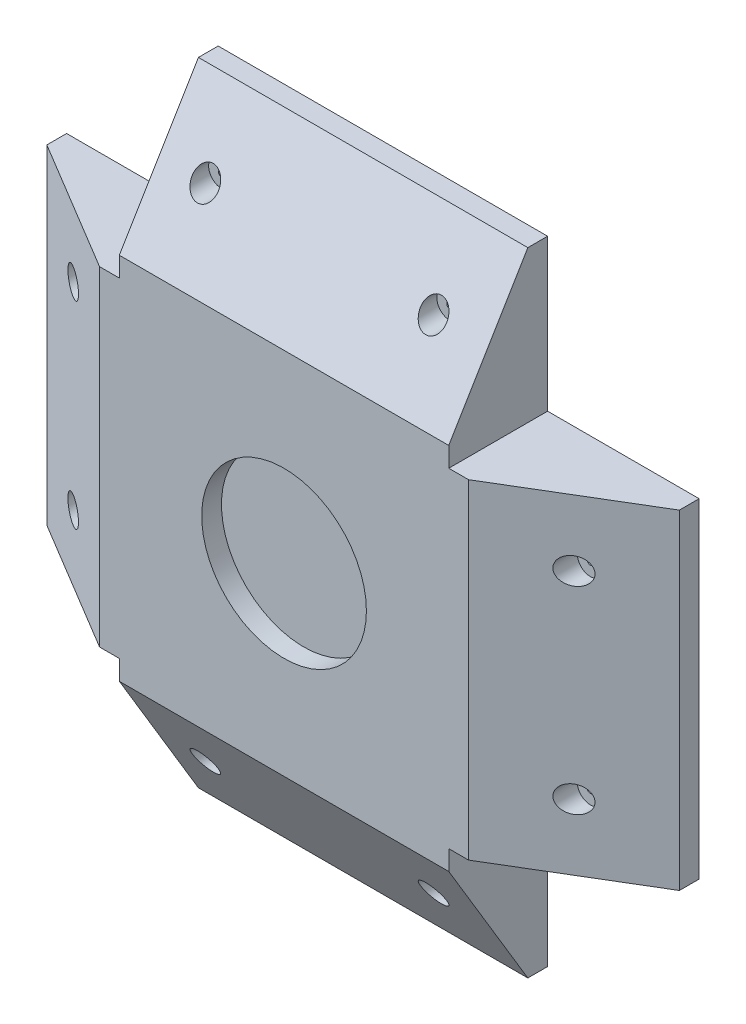
from build123d import *

# Parameters (mm, degrees)
ESQUISSE1_W              = 100
ESQUISSE1_H              = 100
BOSS_EXTRU_1_DEPTH       = 6
ESQUISSE2_W              = 30
ESQUISSE2_H              = 100
BOSS_EXTRU_2_DEPTH       = 6
ESQUISSE3_W              = 30
ESQUISSE3_H              = 100
BOSS_EXTRU_3_DEPTH       = 6
ESQUISSE4_W              = 6
ESQUISSE4_H              = 100
BOSS_EXTRU_4_DEPTH       = 40
ESQUISSE5_W              = 6
ESQUISSE5_H              = 100
BOSS_EXTRU_5_DEPTH       = 40
BOSS_EXTRU_7_DEPTH       = 100
BOSS_EXTRU_8_DEPTH       = 100
ESQUISSE9_R              = 1
ENL_V_MAT_EXTRU_1_DEPTH  = 60
ESQUISSE10_R             = 4
ENL_V_MAT_EXTRU_2_DEPTH  = 17
BOSS_EXTRU_27_DEPTH      = 6
BOSS_EXTRU_27_DEPTH_BACK = 3
ESQUISSE28_W             = 100
ESQUISSE28_H             = 30
ESQUISSE29_W             = 100
ESQUISSE29_H             = 6
BOSS_EXTRU_28_DEPTH      = 40
BOSS_EXTRU_30_DEPTH      = 6
BOSS_EXTRU_30_DEPTH_BACK = 3
ESQUISSE30_W             = 100
ESQUISSE30_H             = 30
ESQUISSE31_W             = 100
ESQUISSE31_H             = 6
BOSS_EXTRU_31_DEPTH      = 40
BOSS_EXTRU_32_DEPTH      = 100
BOSS_EXTRU_33_DEPTH      = 100
ESQUISSE34_R             = 1
ENL_V_MAT_EXTRU_7_DEPTH  = 100
ESQUISSE35_R             = 4
ENL_V_MAT_EXTRU_8_DEPTH  = 17
ESQUISSE36_R             = 25
ENL_V_MAT_EXTRU_9_DEPTH  = 6
ESQUISSE37_W             = 100
ESQUISSE37_H             = 94.110781927
BOSS_EXTRU_34_DEPTH      = 24


with BuildPart() as part:
    # Esquisse1 → Boss.-Extru.1 (new body)
    with BuildSketch(Plane.XY):
        Rectangle(ESQUISSE1_W, ESQUISSE1_H)
    extrude(amount=BOSS_EXTRU_1_DEPTH)

    # Esquisse2 → Boss.-Extru.2 (add)
    with BuildSketch(Plane.ZY.offset(50)):
        with Locations((-9, 0)):
            Rectangle(ESQUISSE2_W, ESQUISSE2_H)
    extrude(amount=BOSS_EXTRU_2_DEPTH)

    # Esquisse3 → Boss.-Extru.3 (add)
    with BuildSketch(Plane(origin=(50, 0, 0), x_dir=(0, 0, -1), z_dir=(1, 0, 0))):
        with Locations((9, 0)):
            Rectangle(ESQUISSE3_W, ESQUISSE3_H)
    extrude(amount=BOSS_EXTRU_3_DEPTH)

    # Esquisse4 → Boss.-Extru.4 (add)
    with BuildSketch(Plane(origin=(56, 0, 0), x_dir=(0, 0, -1), z_dir=(1, 0, 0))):
        with Locations((21, 0)):
            Rectangle(ESQUISSE4_W, ESQUISSE4_H)
    extrude(amount=BOSS_EXTRU_4_DEPTH)

    # Esquisse5 → Boss.-Extru.5 (add)
    with BuildSketch(Plane.ZY.offset(56)):
        with Locations((-21, 0)):
            Rectangle(ESQUISSE5_W, ESQUISSE5_H)
    extrude(amount=BOSS_EXTRU_5_DEPTH)

    # Esquisse6 → Boss.-Extru.7 (add)
    with BuildSketch(Plane(origin=(0, 50, 0), x_dir=(1, 0, 0), z_dir=(0, 1, 0))):
        Polygon((-56, -6), (-56, 18), (-96, 18), align=None)
    extrude(amount=-BOSS_EXTRU_7_DEPTH)

    # Esquisse8 → Boss.-Extru.8 (add)
    with BuildSketch(Plane(origin=(0, -50, 0), x_dir=(-1, 0, 0), z_dir=(0, -1, 0))):
        Polygon((-56, -6), (-96, 18), (-56, 18), align=None)
    extrude(amount=-BOSS_EXTRU_8_DEPTH)

    # Esquisse9 → Enlèv. mat.-Extru.1 (cut)
    with BuildSketch(Plane(origin=(0, 0, -24), x_dir=(-1, 0, 0), z_dir=(0, 0, -1))):
        with Locations((-76, 30)):
            Circle(ESQUISSE9_R)
        with Locations((-76, -30)):
            Circle(ESQUISSE9_R)
        with Locations((76, -30)):
            Circle(ESQUISSE9_R)
        with Locations((76, 30)):
            Circle(ESQUISSE9_R)
    extrude(amount=-ENL_V_MAT_EXTRU_1_DEPTH, mode=Mode.SUBTRACT)

    # Esquisse10 → Enlèv. mat.-Extru.2 (cut)
    with BuildSketch(Plane.XY.offset(6)):
        with Locations((76, 30)):
            Circle(ESQUISSE10_R)
        with Locations((76, -30)):
            Circle(ESQUISSE10_R)
        with Locations((-76, -30)):
            Circle(ESQUISSE10_R)
        with Locations((-76, 30)):
            Circle(ESQUISSE10_R)
    extrude(amount=-ENL_V_MAT_EXTRU_2_DEPTH, mode=Mode.SUBTRACT)

    # Esquisse28 → Boss.-Extru.27 (add, two sides: drawn at the far end of the back side and taken through both)
    with BuildSketch(Plane(origin=(0, -50, 0), x_dir=(-1, 0, 0), z_dir=(0, -1, 0)).offset(-BOSS_EXTRU_27_DEPTH_BACK)):
        with Locations((0, 9)):
            Rectangle(ESQUISSE28_W, ESQUISSE28_H)
    extrude(amount=BOSS_EXTRU_27_DEPTH + BOSS_EXTRU_27_DEPTH_BACK)

    # Esquisse29 → Boss.-Extru.28 (add)
    with BuildSketch(Plane(origin=(0, -56, 0), x_dir=(-1, 0, 0), z_dir=(0, -1, 0))):
        with Locations((0, 21)):
            Rectangle(ESQUISSE29_W, ESQUISSE29_H)
    extrude(amount=BOSS_EXTRU_28_DEPTH)

    # Esquisse30 → Boss.-Extru.30 (add, two sides: drawn at the far end of the back side and taken through both)
    with BuildSketch(Plane(origin=(0, 50, 0), x_dir=(1, 0, 0), z_dir=(0, 1, 0)).offset(-BOSS_EXTRU_30_DEPTH_BACK)):
        with Locations((0, 9)):
            Rectangle(ESQUISSE30_W, ESQUISSE30_H)
    extrude(amount=BOSS_EXTRU_30_DEPTH + BOSS_EXTRU_30_DEPTH_BACK)

    # Esquisse31 → Boss.-Extru.31 (add)
    with BuildSketch(Plane(origin=(0, 56, 0), x_dir=(1, 0, 0), z_dir=(0, 1, 0))):
        with Locations((0, 21)):
            Rectangle(ESQUISSE31_W, ESQUISSE31_H)
    extrude(amount=BOSS_EXTRU_31_DEPTH)

    # Esquisse32 → Boss.-Extru.32 (add)
    with BuildSketch(Plane.ZY.offset(50)):
        Polygon((-18, -56), (6, -56), (-18, -96), align=None)
    extrude(amount=-BOSS_EXTRU_32_DEPTH)

    # Esquisse33 → Boss.-Extru.33 (add)
    with BuildSketch(Plane.ZY.offset(50)):
        Polygon((-18, 56), (6, 56), (-18, 96), align=None)
    extrude(amount=-BOSS_EXTRU_33_DEPTH)

    # Esquisse34 → Enlèv. mat.-Extru.7 (cut)
    with BuildSketch(Plane.XY.offset(6)):
        with Locations(Location((-35.892206296, -76, 0), (0, 0, 90))):
            Circle(ESQUISSE34_R)
        with Locations(Location((33.387808828, -76, 0), (0, 0, 90))):
            Circle(ESQUISSE34_R)
        with Locations(Location((33.387808828, 76, 0), (0, 0, 270))):
            Circle(ESQUISSE34_R)
        with Locations(Location((-35.892206296, 76, 0), (0, 0, 270))):
            Circle(ESQUISSE34_R)
    extrude(amount=-ENL_V_MAT_EXTRU_7_DEPTH, mode=Mode.SUBTRACT)

    # Esquisse35 → Enlèv. mat.-Extru.8 (cut)
    with BuildSketch(Plane.XY.offset(6)):
        with Locations((33.387808828, -76)):
            Circle(ESQUISSE35_R)
        with Locations((-35.892206296, -76)):
            Circle(ESQUISSE35_R)
        with Locations(Location((-35.892206296, 76, 0), (0, 0, 270))):
            Circle(ESQUISSE35_R)
        with Locations(Location((33.387808828, 76, 0), (0, 0, 270))):
            Circle(ESQUISSE35_R)
    extrude(amount=-ENL_V_MAT_EXTRU_8_DEPTH, mode=Mode.SUBTRACT)

    # Esquisse36 → Enlèv. mat.-Extru.9 (cut)
    with BuildSketch(Plane.XY.offset(6)):
        Circle(ESQUISSE36_R)
    extrude(amount=-ENL_V_MAT_EXTRU_9_DEPTH, mode=Mode.SUBTRACT)

    # Esquisse37 → Boss.-Extru.34 (add)
    with BuildSketch(Plane(origin=(0, 0, -24), x_dir=(-1, 0, 0), z_dir=(0, 0, -1))):
        with Locations((0, 0.055390964)):
            Rectangle(ESQUISSE37_W, ESQUISSE37_H)
    extrude(amount=-BOSS_EXTRU_34_DEPTH)


solid = part.part
